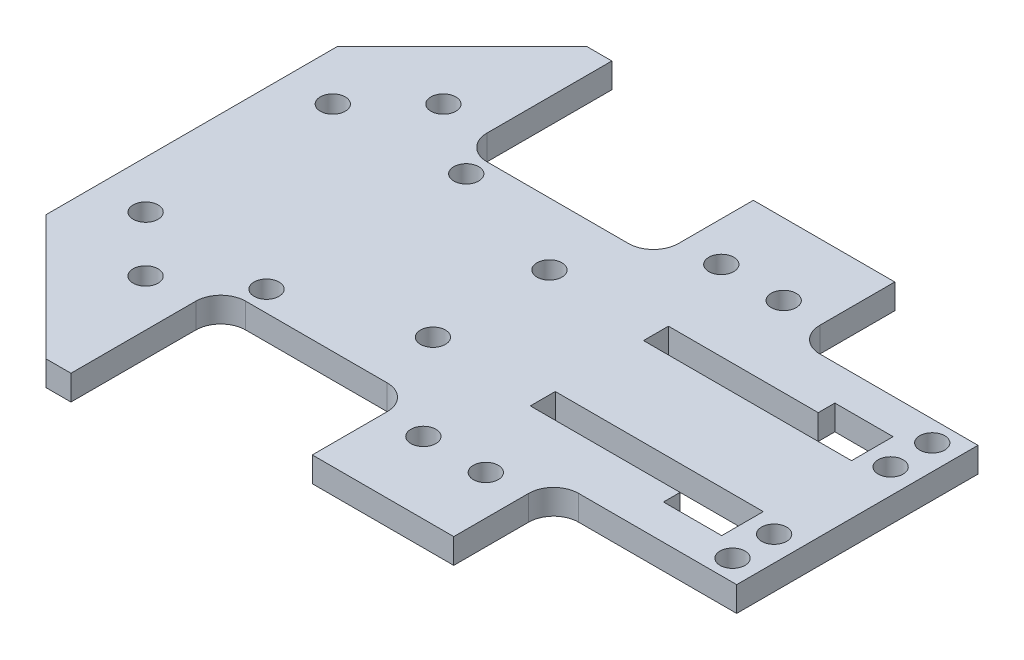
from build123d import *

# Parameters (mm, degrees)
SKETCH1_W           = 80
SKETCH1_H           = 65
BOSS_EXTRUDE1_DEPTH = 3
CUT_EXTRUDE1_DEPTH  = 10
CUT_EXTRUDE2_DEPTH  = 10
SKETCH4_R           = 1.5
CUT_EXTRUDE3_DEPTH  = 10
FILLET1_R           = 3
CUT_EXTRUDE4_DEPTH  = 10


with BuildPart() as part:
    # Sketch1 → Boss-Extrude1 (new body)
    with BuildSketch(Plane(origin=(0, 0, 0), x_dir=(1, 0, 0), z_dir=(0, 1, 0))):
        Rectangle(SKETCH1_W, SKETCH1_H)
    extrude(amount=BOSS_EXTRUDE1_DEPTH)

    # Sketch2 → Cut-Extrude1 (cut)
    with BuildSketch(Plane(origin=(0, 0, 0), x_dir=(-1, 0, 0), z_dir=(0, -1, 0))):
        Polygon((22, 32.5), (22, 14.5), (-1, 14.5), (-1, 26.5), (-18, 26.5), (-18, 14.5), (-40, 14.5), (-40, 32.5), align=None)
        Polygon((-1, -26.5), (-18, -26.5), (-18, -14.5), (-40, -14.5), (-40, -32.5), (22, -32.5), (22, -14.5), (-1, -14.5), align=None)
    extrude(amount=-CUT_EXTRUDE1_DEPTH, mode=Mode.SUBTRACT)

    # Sketch3 → Cut-Extrude2 (cut)
    with BuildSketch(Plane(origin=(0, 3, 0), x_dir=(1, 0, 0), z_dir=(0, 1, 0))):
        Polygon((27, -8.3), (9, -8.3), (9, -5.3), (34, -5.3), (34, -10.3), (27, -10.3), align=None)
        Polygon((34, 5.3), (34, 10.3), (27, 10.3), (27, 8.3), (9, 8.3), (9, 5.3), align=None)
    extrude(amount=-CUT_EXTRUDE2_DEPTH, mode=Mode.SUBTRACT)

    # Sketch4 → Cut-Extrude3 (cut)
    with BuildSketch(Plane(origin=(0, 3, 0), x_dir=(1, 0, 0), z_dir=(0, 1, 0))):
        with Locations(Location((-4, 7, 0), (0, 0, 270))):
            Circle(SKETCH4_R)
        with Locations(Location((13.25, 17.9, 0), (0, 0, 270))):
            Circle(SKETCH4_R)
        with Locations(Location((5.75, 17.9, 0), (0, 0, 270))):
            Circle(SKETCH4_R)
        with Locations(Location((37, 7, 0), (0, 0, 270))):
            Circle(SKETCH4_R)
        with Locations(Location((37, 12, 0), (0, 0, 270))):
            Circle(SKETCH4_R)
        with Locations(Location((-19, 12, 0), (0, 0, 270))):
            Circle(SKETCH4_R)
        with Locations(Location((-27.636753237, 17.892684015, 0), (0, 0, 270))):
            Circle(SKETCH4_R)
        with Locations(Location((-34.28355698, 11.245880272, 0), (0, 0, 270))):
            Circle(SKETCH4_R)
        with Locations(Location((-34.28355698, -11.245880272, 0), (0, 0, 270))):
            Circle(SKETCH4_R)
        with Locations(Location((-27.636753237, -17.892684015, 0), (0, 0, 270))):
            Circle(SKETCH4_R)
        with Locations(Location((-19, -12, 0), (0, 0, 270))):
            Circle(SKETCH4_R)
        with Locations(Location((-4, -7, 0), (0, 0, 270))):
            Circle(SKETCH4_R)
        with Locations(Location((5.75, -17.9, 0), (0, 0, 270))):
            Circle(SKETCH4_R)
        with Locations(Location((13.25, -17.9, 0), (0, 0, 270))):
            Circle(SKETCH4_R)
        with Locations(Location((37, -7, 0), (0, 0, 270))):
            Circle(SKETCH4_R)
        with Locations(Location((37, -12, 0), (0, 0, 270))):
            Circle(SKETCH4_R)
    extrude(amount=-CUT_EXTRUDE3_DEPTH, mode=Mode.SUBTRACT)

    # Fillet1
    fillet1_edges = [part.edges().sort_by_distance(p)[0] for p in [
        (-22, 1.5, -14.5),
        (1, 1.5, -14.5),
        (18, 1.5, -14.5),
        (1, 1.5, 14.5),
        (-22, 1.5, 14.5),
        (18, 1.5, 14.5),
    ]]
    fillet(fillet1_edges, radius=FILLET1_R)

    # Sketch5 → Cut-Extrude4 (cut)
    with BuildSketch(Plane(origin=(0, 0, 0), x_dir=(-1, 0, 0), z_dir=(0, -1, 0))):
        Polygon((40, 32.5), (25, 32.5), (40, 17.5), align=None)
        Polygon((40, -17.5), (40, -32.5), (25, -32.5), align=None)
    extrude(amount=-CUT_EXTRUDE4_DEPTH, mode=Mode.SUBTRACT)


solid = part.part
